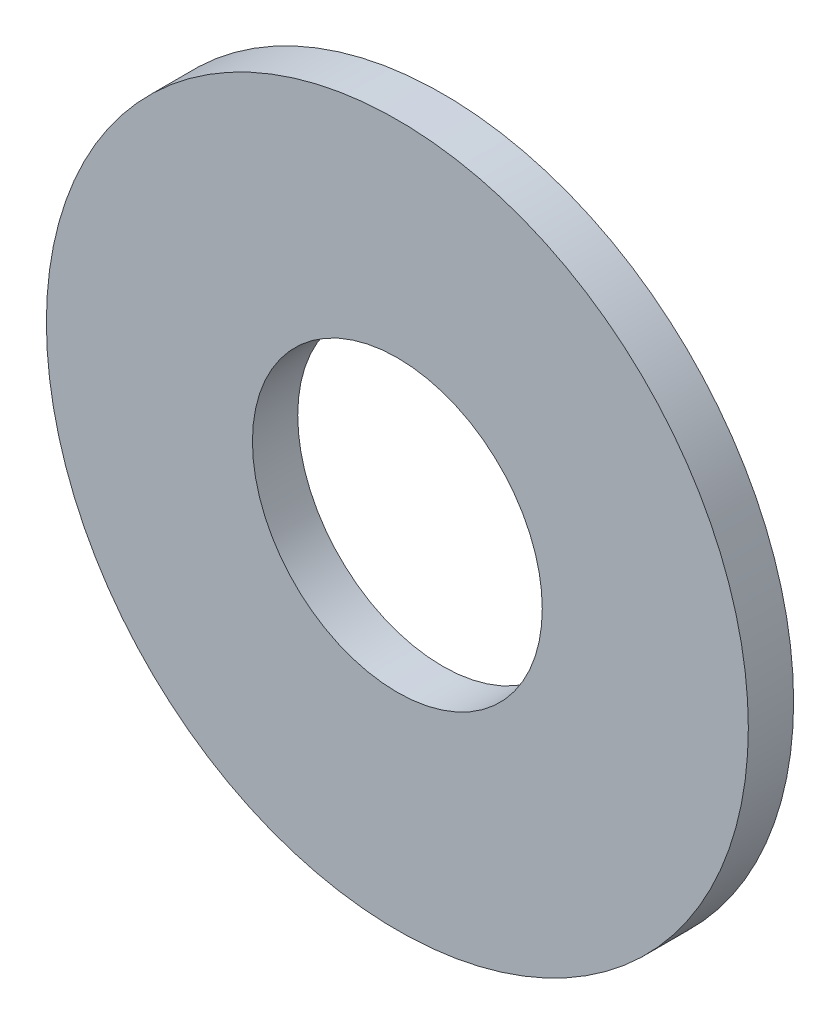
from build123d import *

# Parameters (mm, degrees)
SKETCH1_R           = 49.2125
BOSS_EXTRUDE1_DEPTH = 6.35
SKETCH2_R           = 20.32
CUT_EXTRUDE1_DEPTH  = 6.35


with BuildPart() as part:
    # Sketch1 → Boss-Extrude1 (new body)
    with BuildSketch(Plane.XY):
        Circle(SKETCH1_R)
    extrude(amount=BOSS_EXTRUDE1_DEPTH)

    # Sketch2 → Cut-Extrude1 (cut)
    with BuildSketch(Plane.XY.offset(6.35)):
        Circle(SKETCH2_R)
    extrude(amount=-CUT_EXTRUDE1_DEPTH, mode=Mode.SUBTRACT)


solid = part.part
